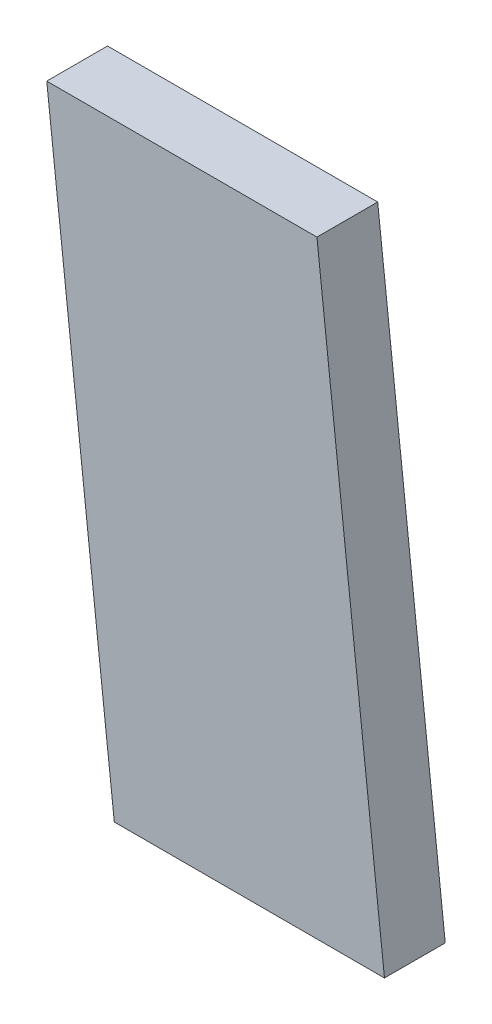
from build123d import *

# Parameters (mm, degrees)
BOSS_EXTRUDE1_DEPTH = 18


with BuildPart() as part:
    # Sketch1 → Boss-Extrude1 (new body)
    with BuildSketch(Plane.XY):
        Polygon((1300, 500), (1280, 680), (1360, 680), (1380, 500), align=None)
    extrude(amount=BOSS_EXTRUDE1_DEPTH)


solid = part.part
